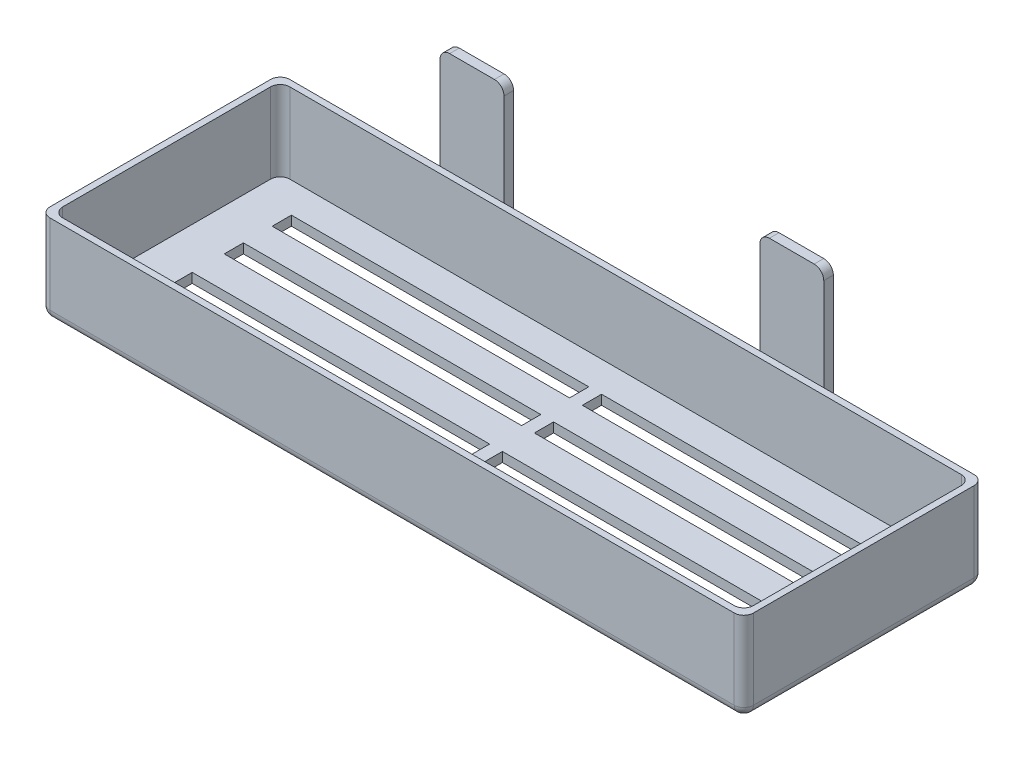
from build123d import *

# Parameters (mm, degrees)
SKIZZE1_W                       = 220
SKIZZE1_H                       = 75
AUFSATZ_LINEAR_AUSTRAGEN1_DEPTH = 3
SKIZZE3_W                       = 20
SKIZZE3_H                       = 3
AUFSATZ_LINEAR_AUSTRAGEN3_DEPTH = 60
SKIZZE4_W                       = 220
SKIZZE4_H                       = 75
AUFSATZ_LINEAR_AUSTRAGEN4_DEPTH = 25
SKIZZE5_W                       = 190
SKIZZE5_H                       = 6
SCHNITT_LINEAR_AUSTRAGEN1_DEPTH = 131.342817217
SKIZZE6_W                       = 4
SKIZZE6_H                       = 52
AUFSATZ_LINEAR_AUSTRAGEN5_DEPTH = 3
VERRUNDUNG1_R                   = 3
VERRUNDUNG2_R                   = 3
VERRUNDUNG3_R                   = 3
VERRUNDUNG4_R                   = 3


with BuildPart() as part:
    # Skizze1 → Aufsatz-Linear austragen1 (new body)
    with BuildSketch(Plane(origin=(0, 0, 0), x_dir=(1, 0, 0), z_dir=(0, 1, 0))):
        Rectangle(SKIZZE1_W, SKIZZE1_H)
    extrude(amount=AUFSATZ_LINEAR_AUSTRAGEN1_DEPTH)

    # Skizze3 → Aufsatz-Linear austragen3 (add)
    with BuildSketch(Plane(origin=(0, 0, 0), x_dir=(1, 0, 0), z_dir=(0, 1, 0))):
        with Locations((50, 39)):
            Rectangle(SKIZZE3_W, SKIZZE3_H)
        with Locations((-50, 39)):
            Rectangle(SKIZZE3_W, SKIZZE3_H)
    extrude(amount=AUFSATZ_LINEAR_AUSTRAGEN3_DEPTH)

    # Skizze4 → Aufsatz-Linear austragen4 (add)
    with BuildSketch(Plane(origin=(0, 3, 0), x_dir=(1, 0, 0), z_dir=(0, 1, 0))):
        Rectangle(SKIZZE4_W, SKIZZE4_H)
        Polygon((108, 35.5), (60, 35.5), (40, 35.5), (-40, 35.5), (-60, 35.5), (-108, 35.5), (-108, -35.5), (108, -35.5), align=None, mode=Mode.SUBTRACT)
    extrude(amount=AUFSATZ_LINEAR_AUSTRAGEN4_DEPTH)

    # Skizze5 → Schnitt-Linear austragen1 (cut, through all)
    with BuildSketch(Plane(origin=(0, 3, 0), x_dir=(1, 0, 0), z_dir=(0, 1, 0))):
        with Locations((0, 23)):
            Rectangle(SKIZZE5_W, SKIZZE5_H)
        with Locations((0, 8)):
            Rectangle(SKIZZE5_W, SKIZZE5_H)
        with Locations((0, -8)):
            Rectangle(SKIZZE5_W, SKIZZE5_H)
        with Locations((0, -23)):
            Rectangle(SKIZZE5_W, SKIZZE5_H)
    extrude(amount=-SCHNITT_LINEAR_AUSTRAGEN1_DEPTH, mode=Mode.SUBTRACT)

    # Skizze6 → Aufsatz-Linear austragen5 (add, through all)
    with BuildSketch(Plane(origin=(0, 3, 0), x_dir=(1, 0, 0), z_dir=(0, 1, 0))):
        Rectangle(SKIZZE6_W, SKIZZE6_H)
    extrude(amount=-AUFSATZ_LINEAR_AUSTRAGEN5_DEPTH)

    # Verrundung1
    verrundung1_edges = [part.edges().sort_by_distance(p)[0] for p in [
        (40, 60, -39),
        (60, 60, -39),
        (-40, 60, -39),
        (-60, 60, -39),
    ]]
    fillet(verrundung1_edges, radius=VERRUNDUNG1_R)

    # Verrundung2
    verrundung2_edges = [part.edges().sort_by_distance(p)[0] for p in [
        (108, 15.5, -35.5),
        (-108, 15.5, -35.5),
        (-108, 15.5, 35.5),
        (108, 15.5, 35.5),
        (110, 14, -37.5),
        (110, 14, 37.5),
        (-110, 14, 37.5),
        (-110, 14, -37.5),
    ]]
    fillet(verrundung2_edges, radius=VERRUNDUNG2_R)

    # Verrundung3
    verrundung3_edges = [part.edges().sort_by_distance(p)[0] for p in [
        (-110, 0, 0),
        (83.5, 0, -37.5),
        (110, 0, 0),
        (0, 0, 37.5),
        (109.121320344, 0, 36.621320344),
        (109.121320344, 0, -36.621320344),
        (-109.121320344, 0, 36.621320344),
        (-109.121320344, 0, -36.621320344),
        (-83.5, 0, -37.5),
    ]]
    fillet(verrundung3_edges, radius=VERRUNDUNG3_R)

    # Verrundung4
    verrundung4_edges = [part.edges().sort_by_distance(p)[0] for p in [
        (0, 0, -37.5),
    ]]
    fillet(verrundung4_edges, radius=VERRUNDUNG4_R)


solid = part.part
